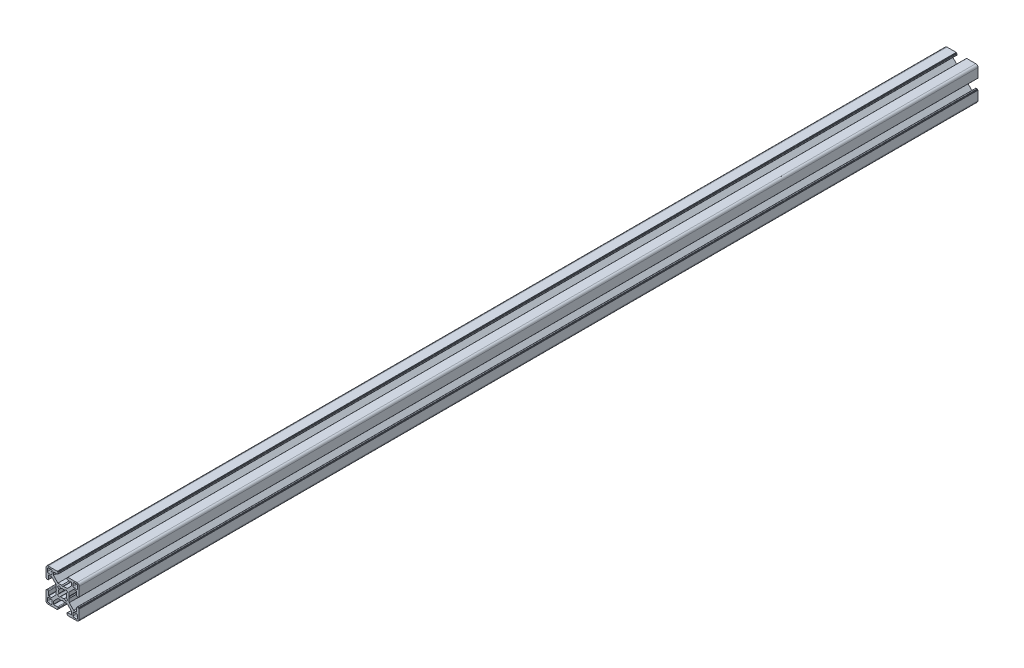
from build123d import *

# Parameters (mm, degrees)
BOSS_EXTRUDE1_DEPTH = 812.8


with BuildPart() as part:
    # Sketch1 → Boss-Extrude1 (new body)
    with BuildSketch(Plane.XY):
        with BuildLine():
            Line((6.00446543, 0.899999619), (5.484852164, 0))
            Line((5.484852164, 0), (6.00446543, -0.899999619))
            Line((6.00446543, -0.899999619), (6.00446543, -4.204465866))
            Line((6.00446543, -4.204465866), (10.049999564, -8.25))
            Line((10.049999564, -8.25), (12.59999928, -8.25))
            ThreePointArc((12.59999928, -8.25), (12.741420837, -8.191421273), (12.799999564, -8.049999716))
            Line((12.799999564, -8.049999716), (12.799999564, -4.649999613))
            ThreePointArc((12.799999564, -4.649999613), (12.975735606, -4.225735278), (13.39999994, -4.049999237))
            Line((13.39999994, -4.049999237), (14.300000043, -4.049999237))
            ThreePointArc((14.300000043, -4.049999237), (14.4414216, -4.108577964), (14.500000327, -4.249999521))
            Line((14.500000327, -4.249999521), (14.500000327, -4.349998953))
            ThreePointArc((14.500000327, -4.349998953), (14.558579054, -4.49142051), (14.700000611, -4.549999237))
            Line((14.700000611, -4.549999237), (14.799999716, -4.549999237))
            ThreePointArc((14.799999716, -4.549999237), (14.941421273, -4.608577964), (15, -4.749999521))
            Line((15, -4.749999521), (15, -13.000000346))
            ThreePointArc((15, -13.000000346), (14.414213664, -14.414213664), (13.000000346, -15))
            Line((13.000000346, -15), (4.749999945, -15))
            ThreePointArc((4.749999945, -15), (4.60857832, -14.941421245), (4.549999564, -14.799999619))
            Line((4.549999564, -14.799999619), (4.549999564, -14.69999942))
            ThreePointArc((4.549999564, -14.69999942), (4.49142109, -14.558578474), (4.350000144, -14.5))
            Line((4.350000144, -14.5), (4.250000374, -14.5))
            ThreePointArc((4.250000374, -14.5), (4.108578753, -14.441421247), (4.05, -14.299999626))
            Line((4.05, -14.299999626), (4.05, -13.399999434))
            ThreePointArc((4.05, -13.399999434), (4.225735989, -12.975735226), (4.650000197, -12.799999237))
            Line((4.650000197, -12.799999237), (8.049999924, -12.799999237))
            ThreePointArc((8.049999924, -12.799999237), (8.191421565, -12.741420475), (8.250000327, -12.599998834))
            Line((8.250000327, -12.599998834), (8.250000327, -10.049999237))
            Line((8.250000327, -10.049999237), (4.204466193, -6))
            Line((4.204466193, -6), (0.899999946, -6))
            Line((0.899999946, -6), (0, -5.484851837))
            Line((0, -5.484851837), (-0.899999946, -6))
            Line((-0.899999946, -6), (-4.204466193, -6))
            Line((-4.204466193, -6), (-8.250000327, -10.049999237))
            Line((-8.250000327, -10.049999237), (-8.250000327, -12.599998834))
            ThreePointArc((-8.250000327, -12.599998834), (-8.191421565, -12.741420475), (-8.049999924, -12.799999237))
            Line((-8.049999924, -12.799999237), (-4.650000197, -12.799999237))
            ThreePointArc((-4.650000197, -12.799999237), (-4.225735989, -12.975735226), (-4.05, -13.399999434))
            Line((-4.05, -13.399999434), (-4.05, -14.299999626))
            ThreePointArc((-4.05, -14.299999626), (-4.108578753, -14.441421247), (-4.250000374, -14.5))
            Line((-4.250000374, -14.5), (-4.350000144, -14.5))
            ThreePointArc((-4.350000144, -14.5), (-4.49142109, -14.558578474), (-4.549999564, -14.69999942))
            Line((-4.549999564, -14.69999942), (-4.549999564, -14.799999619))
            ThreePointArc((-4.549999564, -14.799999619), (-4.60857832, -14.941421245), (-4.749999945, -15))
            Line((-4.749999945, -15), (-13.000000346, -15))
            ThreePointArc((-13.000000346, -15), (-14.414213664, -14.414213664), (-15, -13.000000346))
            Line((-15, -13.000000346), (-15, -4.749999521))
            ThreePointArc((-15, -4.749999521), (-14.941421273, -4.608577964), (-14.799999716, -4.549999237))
            Line((-14.799999716, -4.549999237), (-14.700000611, -4.549999237))
            ThreePointArc((-14.700000611, -4.549999237), (-14.558579054, -4.49142051), (-14.500000327, -4.349998953))
            Line((-14.500000327, -4.349998953), (-14.500000327, -4.249999521))
            ThreePointArc((-14.500000327, -4.249999521), (-14.4414216, -4.108577964), (-14.300000043, -4.049999237))
            Line((-14.300000043, -4.049999237), (-13.39999994, -4.049999237))
            ThreePointArc((-13.39999994, -4.049999237), (-12.975735606, -4.225735278), (-12.799999564, -4.649999613))
            Line((-12.799999564, -4.649999613), (-12.799999564, -8.049999716))
            ThreePointArc((-12.799999564, -8.049999716), (-12.741420837, -8.191421273), (-12.59999928, -8.25))
            Line((-12.59999928, -8.25), (-10.049999564, -8.25))
            Line((-10.049999564, -8.25), (-6.00446543, -4.204465866))
            Line((-6.00446543, -4.204465866), (-6.00446543, -0.899999619))
            Line((-6.00446543, -0.899999619), (-5.484852164, 0))
            Line((-5.484852164, 0), (-6.00446543, 0.899999619))
            Line((-6.00446543, 0.899999619), (-6.00446543, 4.204465866))
            Line((-6.00446543, 4.204465866), (-10.049999564, 8.25))
            Line((-10.049999564, 8.25), (-12.59999928, 8.25))
            ThreePointArc((-12.59999928, 8.25), (-12.741420837, 8.191421273), (-12.799999564, 8.049999716))
            Line((-12.799999564, 8.049999716), (-12.799999564, 4.649999613))
            ThreePointArc((-12.799999564, 4.649999613), (-12.975735606, 4.225735278), (-13.39999994, 4.049999237))
            Line((-13.39999994, 4.049999237), (-14.300000043, 4.049999237))
            ThreePointArc((-14.300000043, 4.049999237), (-14.4414216, 4.108577964), (-14.500000327, 4.249999521))
            Line((-14.500000327, 4.249999521), (-14.500000327, 4.349998953))
            ThreePointArc((-14.500000327, 4.349998953), (-14.558579054, 4.49142051), (-14.700000611, 4.549999237))
            Line((-14.700000611, 4.549999237), (-14.799999716, 4.549999237))
            ThreePointArc((-14.799999716, 4.549999237), (-14.941421273, 4.608577964), (-15, 4.749999521))
            Line((-15, 4.749999521), (-15, 13.000000346))
            ThreePointArc((-15, 13.000000346), (-14.414213664, 14.414213664), (-13.000000346, 15))
            Line((-13.000000346, 15), (-4.749999945, 15))
            ThreePointArc((-4.749999945, 15), (-4.60857832, 14.941421245), (-4.549999564, 14.799999619))
            Line((-4.549999564, 14.799999619), (-4.549999564, 14.69999942))
            ThreePointArc((-4.549999564, 14.69999942), (-4.49142109, 14.558578474), (-4.350000144, 14.5))
            Line((-4.350000144, 14.5), (-4.250000374, 14.5))
            ThreePointArc((-4.250000374, 14.5), (-4.108578753, 14.441421247), (-4.05, 14.299999626))
            Line((-4.05, 14.299999626), (-4.05, 13.399999434))
            ThreePointArc((-4.05, 13.399999434), (-4.225735989, 12.975735226), (-4.650000197, 12.799999237))
            Line((-4.650000197, 12.799999237), (-8.049999924, 12.799999237))
            ThreePointArc((-8.049999924, 12.799999237), (-8.191421565, 12.741420475), (-8.250000327, 12.599998834))
            Line((-8.250000327, 12.599998834), (-8.250000327, 10.049999237))
            Line((-8.250000327, 10.049999237), (-4.204466193, 6))
            Line((-4.204466193, 6), (-0.899999946, 6))
            Line((-0.899999946, 6), (0, 5.484851837))
            Line((0, 5.484851837), (0.899999946, 6))
            Line((0.899999946, 6), (4.204466193, 6))
            Line((4.204466193, 6), (8.250000327, 10.049999237))
            Line((8.250000327, 10.049999237), (8.250000327, 12.599998834))
            ThreePointArc((8.250000327, 12.599998834), (8.191421565, 12.741420475), (8.049999924, 12.799999237))
            Line((8.049999924, 12.799999237), (4.650000197, 12.799999237))
            ThreePointArc((4.650000197, 12.799999237), (4.225735989, 12.975735226), (4.05, 13.399999434))
            Line((4.05, 13.399999434), (4.05, 14.299999626))
            ThreePointArc((4.05, 14.299999626), (4.108578753, 14.441421247), (4.250000374, 14.5))
            Line((4.250000374, 14.5), (4.350000144, 14.5))
            ThreePointArc((4.350000144, 14.5), (4.49142109, 14.558578474), (4.549999564, 14.69999942))
            Line((4.549999564, 14.69999942), (4.549999564, 14.799999619))
            ThreePointArc((4.549999564, 14.799999619), (4.60857832, 14.941421245), (4.749999945, 15))
            Line((4.749999945, 15), (13.000000346, 15))
            ThreePointArc((13.000000346, 15), (14.414213664, 14.414213664), (15, 13.000000346))
            Line((15, 13.000000346), (15, 4.749999521))
            ThreePointArc((15, 4.749999521), (14.941421273, 4.608577964), (14.799999716, 4.549999237))
            Line((14.799999716, 4.549999237), (14.700000611, 4.549999237))
            ThreePointArc((14.700000611, 4.549999237), (14.558579054, 4.49142051), (14.500000327, 4.349998953))
            Line((14.500000327, 4.349998953), (14.500000327, 4.249999521))
            ThreePointArc((14.500000327, 4.249999521), (14.4414216, 4.108577964), (14.300000043, 4.049999237))
            Line((14.300000043, 4.049999237), (13.39999994, 4.049999237))
            ThreePointArc((13.39999994, 4.049999237), (12.975735606, 4.225735278), (12.799999564, 4.649999613))
            Line((12.799999564, 4.649999613), (12.799999564, 8.049999716))
            ThreePointArc((12.799999564, 8.049999716), (12.741420837, 8.191421273), (12.59999928, 8.25))
            Line((12.59999928, 8.25), (10.049999564, 8.25))
            Line((10.049999564, 8.25), (6.00446543, 4.204465866))
            Line((6.00446543, 4.204465866), (6.00446543, 0.899999619))
        make_face()
        with BuildLine():
            Line((13.70000109, 12.700000398), (13.70000109, 10.499999635))
            ThreePointArc((13.70000109, 10.499999635), (13.407107874, 9.792892851), (12.70000109, 9.499999635))
            Line((12.70000109, 9.499999635), (10.500000327, 9.499999635))
            ThreePointArc((10.500000327, 9.499999635), (9.792893543, 9.792892851), (9.500000327, 10.499999635))
            Line((9.500000327, 10.499999635), (9.500000327, 12.700000398))
            ThreePointArc((9.500000327, 12.700000398), (9.792893543, 13.407107182), (10.500000327, 13.700000398))
            Line((10.500000327, 13.700000398), (12.70000109, 13.700000398))
            ThreePointArc((12.70000109, 13.700000398), (13.407107874, 13.407107182), (13.70000109, 12.700000398))
        make_face(mode=Mode.SUBTRACT)
        with BuildLine():
            Line((3.135929412, 4.518400903), (1.600129524, 3.280561767))
            ThreePointArc((1.600129524, 3.280561767), (0, 3.65), (-1.600129524, 3.280561767))
            Line((-1.600129524, 3.280561767), (-3.135929412, 4.518400903))
            ThreePointArc((-3.135929412, 4.518400903), (-3.881002259, 3.897155561), (-4.505336892, 3.154669473))
            Line((-4.505336892, 3.154669473), (-3.280561732, 1.600129597))
            ThreePointArc((-3.280561732, 1.600129597), (-3.65, 0), (-3.280561732, -1.600129597))
            Line((-3.280561732, -1.600129597), (-4.505336892, -3.154669473))
            ThreePointArc((-4.505336892, -3.154669473), (-3.881002259, -3.897155561), (-3.135929412, -4.518400903))
            Line((-3.135929412, -4.518400903), (-1.600129524, -3.280561767))
            ThreePointArc((-1.600129524, -3.280561767), (0, -3.65), (1.600129524, -3.280561767))
            Line((1.600129524, -3.280561767), (3.135929412, -4.518400903))
            ThreePointArc((3.135929412, -4.518400903), (3.881002259, -3.897155561), (4.505336892, -3.154669473))
            Line((4.505336892, -3.154669473), (3.280561732, -1.600129597))
            ThreePointArc((3.280561732, -1.600129597), (3.65, 0), (3.280561732, 1.600129597))
            Line((3.280561732, 1.600129597), (4.505336892, 3.154669473))
            ThreePointArc((4.505336892, 3.154669473), (3.881002259, 3.897155561), (3.135929412, 4.518400903))
        make_face(mode=Mode.SUBTRACT)
        with BuildLine():
            Line((-13.70000109, -12.700000398), (-13.70000109, -10.499999635))
            ThreePointArc((-13.70000109, -10.499999635), (-13.407107874, -9.792892851), (-12.70000109, -9.499999635))
            Line((-12.70000109, -9.499999635), (-10.500000327, -9.499999635))
            ThreePointArc((-10.500000327, -9.499999635), (-9.792893543, -9.792892851), (-9.500000327, -10.499999635))
            Line((-9.500000327, -10.499999635), (-9.500000327, -12.700000398))
            ThreePointArc((-9.500000327, -12.700000398), (-9.792893543, -13.407107182), (-10.500000327, -13.700000398))
            Line((-10.500000327, -13.700000398), (-12.70000109, -13.700000398))
            ThreePointArc((-12.70000109, -13.700000398), (-13.407107874, -13.407107182), (-13.70000109, -12.700000398))
        make_face(mode=Mode.SUBTRACT)
        with BuildLine():
            Line((10.500000327, -13.700000398), (12.70000109, -13.700000398))
            ThreePointArc((12.70000109, -13.700000398), (13.407107874, -13.407107182), (13.70000109, -12.700000398))
            Line((13.70000109, -12.700000398), (13.70000109, -10.499999635))
            ThreePointArc((13.70000109, -10.499999635), (13.407107874, -9.792892851), (12.70000109, -9.499999635))
            Line((12.70000109, -9.499999635), (10.500000327, -9.499999635))
            ThreePointArc((10.500000327, -9.499999635), (9.792893543, -9.792892851), (9.500000327, -10.499999635))
            Line((9.500000327, -10.499999635), (9.500000327, -12.700000398))
            ThreePointArc((9.500000327, -12.700000398), (9.792893543, -13.407107182), (10.500000327, -13.700000398))
        make_face(mode=Mode.SUBTRACT)
        with BuildLine():
            Line((-10.500000327, 13.700000398), (-12.70000109, 13.700000398))
            ThreePointArc((-12.70000109, 13.700000398), (-13.407107874, 13.407107182), (-13.70000109, 12.700000398))
            Line((-13.70000109, 12.700000398), (-13.70000109, 10.499999635))
            ThreePointArc((-13.70000109, 10.499999635), (-13.407107874, 9.792892851), (-12.70000109, 9.499999635))
            Line((-12.70000109, 9.499999635), (-10.500000327, 9.499999635))
            ThreePointArc((-10.500000327, 9.499999635), (-9.792893543, 9.792892851), (-9.500000327, 10.499999635))
            Line((-9.500000327, 10.499999635), (-9.500000327, 12.700000398))
            ThreePointArc((-9.500000327, 12.700000398), (-9.792893543, 13.407107182), (-10.500000327, 13.700000398))
        make_face(mode=Mode.SUBTRACT)
    extrude(amount=BOSS_EXTRUDE1_DEPTH)


solid = part.part
